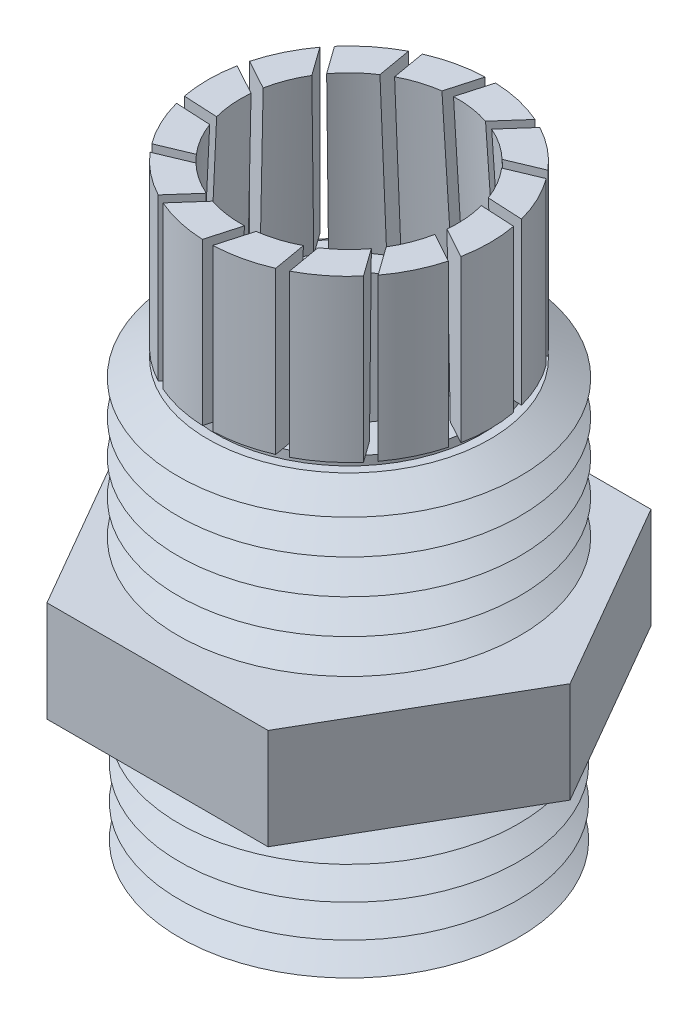
from build123d import *

# Parameters (mm, degrees)
BOSS_EXTRUDE1_DEPTH = 2.5
CUT_EXTRUDE1_DEPTH  = 8
CIRPATTERN1_COUNT   = 14
CUT_EXTRUDE2_START  = -10
SKETCH5_R           = 5
CUT_EXTRUDE2_DEPTH  = 10


with BuildPart() as part:
    # Sketch1 → Revolve1 (revolve)
    with BuildSketch(Plane.XY, mode=Mode.PRIVATE) as revolve1_sk:
        Polygon((-5, -1.7), (-5, -14.966593737), (-7, -14.966593737), (-8.41, -14.152529857), (-7, -13.338465977), (-8.41, -12.524402098), (-7, -11.710338218), (-8.41, -10.896274339), (-7, -10.082210459), (-8.41, -9.26814658), (-7, -8.4540827), (-8.41, -7.640018821), (-7, -7), (-7, -2), (-8.481548045, -1.144627838), (-7, -0.289255675), (-8.481548045, 0.566116487), (-7, 1.42148865), (-8.481548045, 2.276860812), (-7, 3.132232974), (-8.481548045, 3.987605137), (-7, 4.842977299), (-8.481548045, 5.698349462), (-7, 6.553721624), (-6.800767408, 6.553721624), (-6.577224477, 6.553721624), (-6.577224477, 7), (-7, 7), (-7, 15), (-5.371576334, 15), (-5.753711326, 7), (-5.371576334, 7), (-4.595145819, 7), align=None)
    revolve(revolve1_sk.sketch.rotate(Axis((0, -16.464923423, 0), (0, 1, 0)), 270), axis=Axis((0, -16.464923423, 0), (0, 1, 0)))

    # Sketch2 → Boss-Extrude1 (add, symmetric)
    with BuildSketch(Plane.XZ.offset(4.466593737)):
        Polygon((10.969655115, 0), (5.484827557, 9.5), (-5.484827557, 9.5), (-10.969655115, 0), (-5.484827557, -9.5), (5.484827557, -9.5), align=None)
    extrude(amount=BOSS_EXTRUDE1_DEPTH, both=True)

    # Sketch4 → Cut-Extrude1 (cut)
    with BuildSketch(Plane(origin=(0, 15, 0), x_dir=(1, 0, 0), z_dir=(0, 1, 0))):
        Polygon((-8.353753696, 8.845150972), (-2.200605193, 0.256381188), (-2.627907173, 0), (-8.80128537, 8.617007067), align=None)
    cut_extrude1 = extrude(amount=-CUT_EXTRUDE1_DEPTH, mode=Mode.SUBTRACT)

    # CirPattern1: Cut-Extrude1 ×14 about axis
    cirpattern1_axis = Axis((0, 0, 0), (0, 1, 0))
    for i in range(1, CIRPATTERN1_COUNT):
        add(cut_extrude1.rotate(cirpattern1_axis, i * 360 / CIRPATTERN1_COUNT), mode=Mode.SUBTRACT)

    # Sketch5 → Cut-Extrude2 (cut)
    with BuildSketch(Plane(origin=(0, -1.966593737, 0), x_dir=(1, 0, 0), z_dir=(0, 1, 0)).offset(CUT_EXTRUDE2_START)):
        with Locations(Location((0, 0, 0), (0, 0, 90))):
            Circle(SKETCH5_R)
    extrude(amount=CUT_EXTRUDE2_DEPTH, mode=Mode.SUBTRACT)


solid = part.part
